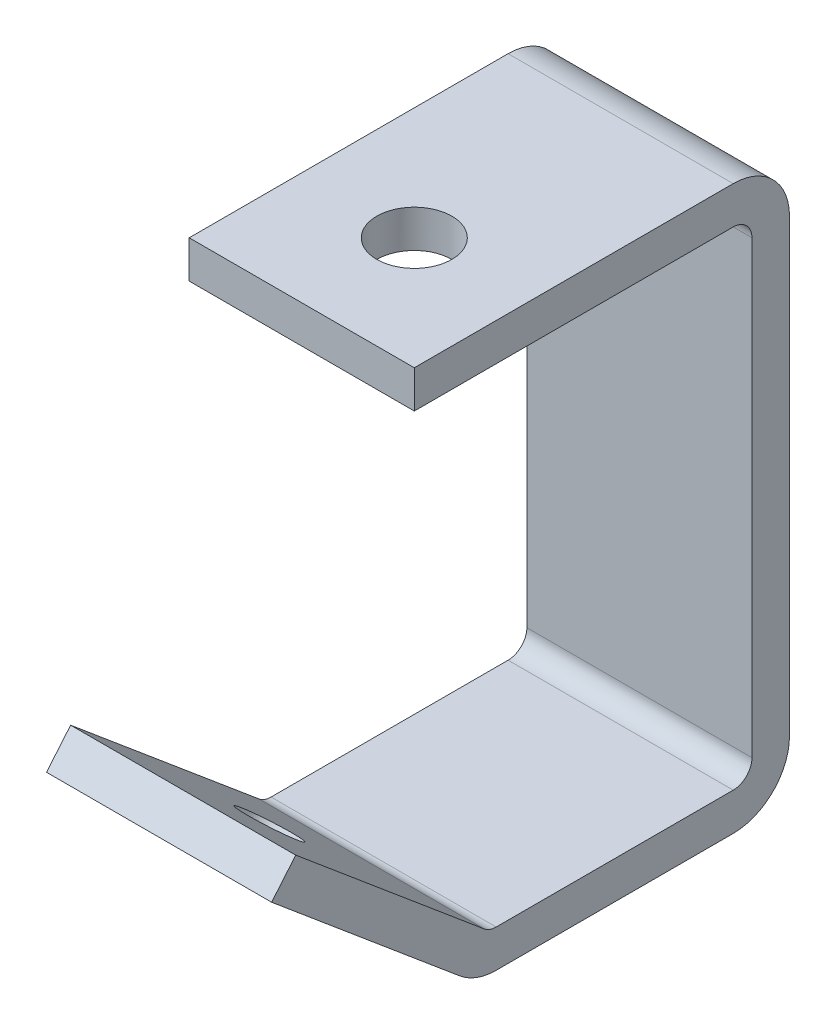
from build123d import *

# Parameters (mm, degrees)
BASE_EXTRUDE_THIN_DEPTH = 19.05
CUT_EXTRUDE1_REACH      = 128.668
SKETCH2_R               = 6.35
SKETCH3_R               = 4.7625
CUT_EXTRUDE2_DEPTH      = 129.830279167


with BuildPart() as part:
    # Sketch1 → Base-Extrude-Thin (new, symmetric)
    with BuildSketch(Plane(origin=(0, 0, 0), x_dir=(0, 0, -1), z_dir=(1, 0, 0))):
        with BuildLine():
            Line((-77.216478592, 27.494340102), (-45.335245167, 0.742808893))
            ThreePointArc((-45.335245167, 0.742808893), (-44.380308461, 0.191475929), (-43.294394506, 0))
            Line((-43.294394506, 0), (-3.175, 0))
            ThreePointArc((-3.175, 0), (-0.92993597, 0.92993597), (0, 3.175))
            Line((0, 3.175), (0, 79.375))
            ThreePointArc((0, 79.375), (-0.92993597, 81.62006403), (-3.175, 82.55))
            Line((-3.175, 82.55), (-57.15, 82.55))
            Line((-57.15, 82.55), (-57.15, 88.9))
            Line((-57.15, 88.9), (-3.175, 88.9))
            ThreePointArc((-3.175, 88.9), (3.560192091, 86.110192091), (6.35, 79.375))
            Line((6.35, 79.375), (6.35, 3.175))
            ThreePointArc((6.35, 3.175), (3.560192091, -3.560192091), (-3.175, -6.35))
            Line((-3.175, -6.35), (-43.294394506, -6.35))
            ThreePointArc((-43.294394506, -6.35), (-46.552136371, -5.775572213), (-49.416946488, -4.121573321))
            Line((-49.416946488, -4.121573321), (-81.298179914, 22.629957888))
            Line((-81.298179914, 22.629957888), (-77.216478592, 27.494340102))
        make_face()
    extrude(amount=BASE_EXTRUDE_THIN_DEPTH, both=True)

    # Sketch2 → Cut-Extrude1 (cut, up to next)
    with BuildSketch(Plane(origin=(0, 88.9, 0), x_dir=(-1, 0, 0), z_dir=(0, 1, 0)), mode=Mode.PRIVATE) as cut_extrude1_sk1:
        with Locations(Location((0, 38.1, 0), (0, 0, 90))):
            Circle(SKETCH2_R)
    cut_extrude1_tool1 = extrude(cut_extrude1_sk1.sketch, amount=-CUT_EXTRUDE1_REACH, mode=Mode.PRIVATE) & part.part
    add(cut_extrude1_tool1.solids().sort_by_distance((0, 88.9, 38.1))[0], mode=Mode.SUBTRACT)

    # Sketch3 → Cut-Extrude2 (cut, through all)
    with BuildSketch(Plane(origin=(0, -21.887352311, 18.365669251), x_dir=(1, 0, 0), z_dir=(0, 0.766044443118977, -0.6427876096865405))):
        with Locations(Location((0, -57.758202533, 0), (0, 0, 270))):
            Circle(SKETCH3_R)
    extrude(amount=-CUT_EXTRUDE2_DEPTH, mode=Mode.SUBTRACT)


solid = part.part
